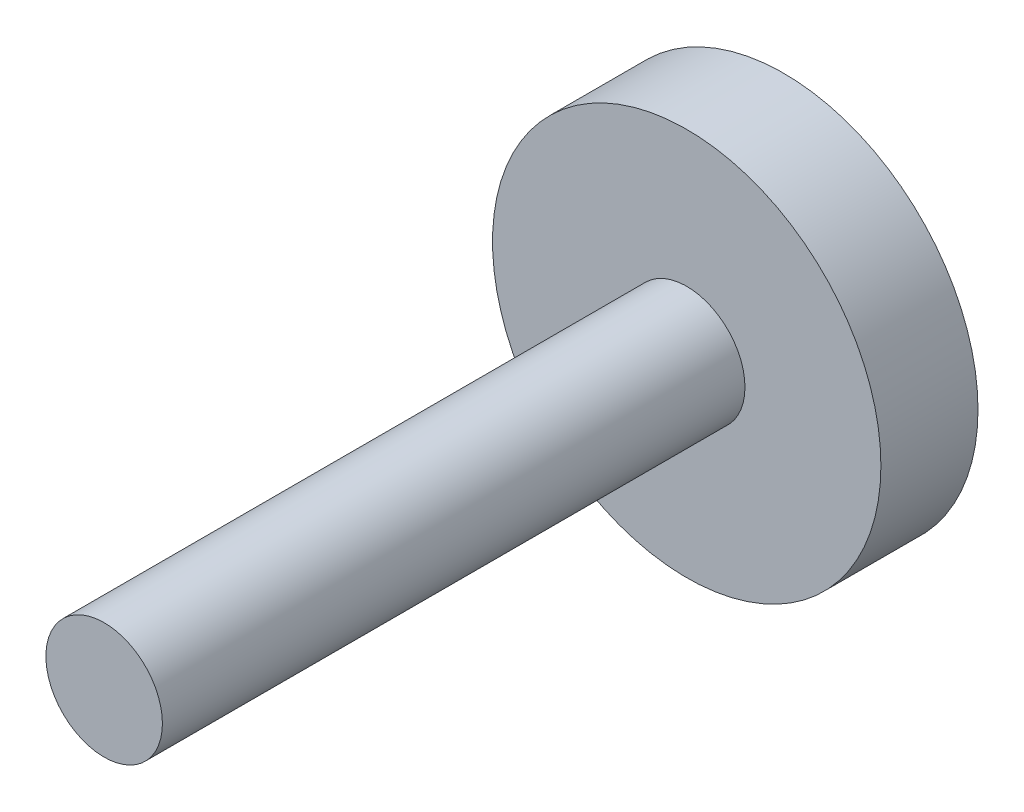
from build123d import *

# Parameters (mm, degrees)
SKETCH1_R           = 5
BOSS_EXTRUDE1_DEPTH = 1.25
SKETCH2_R           = 1.5
BOSS_EXTRUDE2_DEPTH = 15


with BuildPart() as part:
    # Sketch1 → Boss-Extrude1 (new, symmetric)
    with BuildSketch(Plane.XY):
        Circle(SKETCH1_R)
    extrude(amount=BOSS_EXTRUDE1_DEPTH, both=True)

    # Sketch2 → Boss-Extrude2 (add)
    with BuildSketch(Plane.XY.offset(1.25)):
        Circle(SKETCH2_R)
    extrude(amount=BOSS_EXTRUDE2_DEPTH)


solid = part.part
